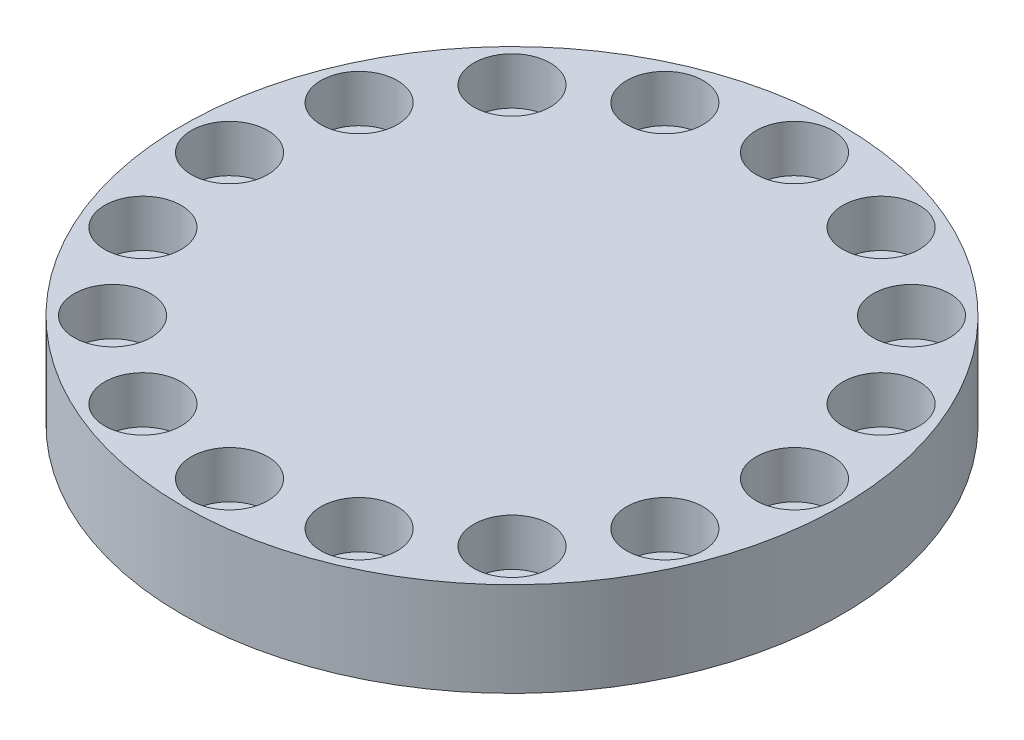
from build123d import *

# Parameters (mm, degrees)
SKETCH1_R                                        = 88.9
BOSS_EXTRUDE1_DEPTH                              = 25.4
CBORE_FOR_1_2_SOCKET_HEAD_CAP_SCREW1_D           = 13.49248
CBORE_FOR_1_2_SOCKET_HEAD_CAP_SCREW1_CBORE_D     = 20.6375
CBORE_FOR_1_2_SOCKET_HEAD_CAP_SCREW1_CBORE_DEPTH = 12.7
CIRPATTERN1_COUNT                                = 16


with BuildPart() as part:
    # Sketch1 → Boss-Extrude1 (new body)
    with BuildSketch(Plane(origin=(0, 0, 0), x_dir=(1, 0, 0), z_dir=(0, 1, 0))):
        with Locations(Location((0, 0, 0), (0, 0, 270))):
            Circle(SKETCH1_R)
    extrude(amount=-BOSS_EXTRUDE1_DEPTH)

    # CBORE for 1/2 Socket Head Cap Screw1 (through all)
    with Locations(Plane(origin=(0, 0, 0), x_dir=(1, 0, 0), z_dir=(0, 1, 0))):
        with Locations((0, 76.2)):
            cbore_for_1_2_socket_head_cap_screw1 = CounterBoreHole(CBORE_FOR_1_2_SOCKET_HEAD_CAP_SCREW1_D / 2, CBORE_FOR_1_2_SOCKET_HEAD_CAP_SCREW1_CBORE_D / 2, CBORE_FOR_1_2_SOCKET_HEAD_CAP_SCREW1_CBORE_DEPTH)

    # CirPattern1: CBORE for 1/2 Socket Head Cap Screw1 ×16 about axis
    cirpattern1_axis = Axis((0, 0, 0), (0, 1, 0))
    for i in range(1, CIRPATTERN1_COUNT):
        add(cbore_for_1_2_socket_head_cap_screw1.rotate(cirpattern1_axis, i * 360 / CIRPATTERN1_COUNT), mode=Mode.SUBTRACT)


solid = part.part
